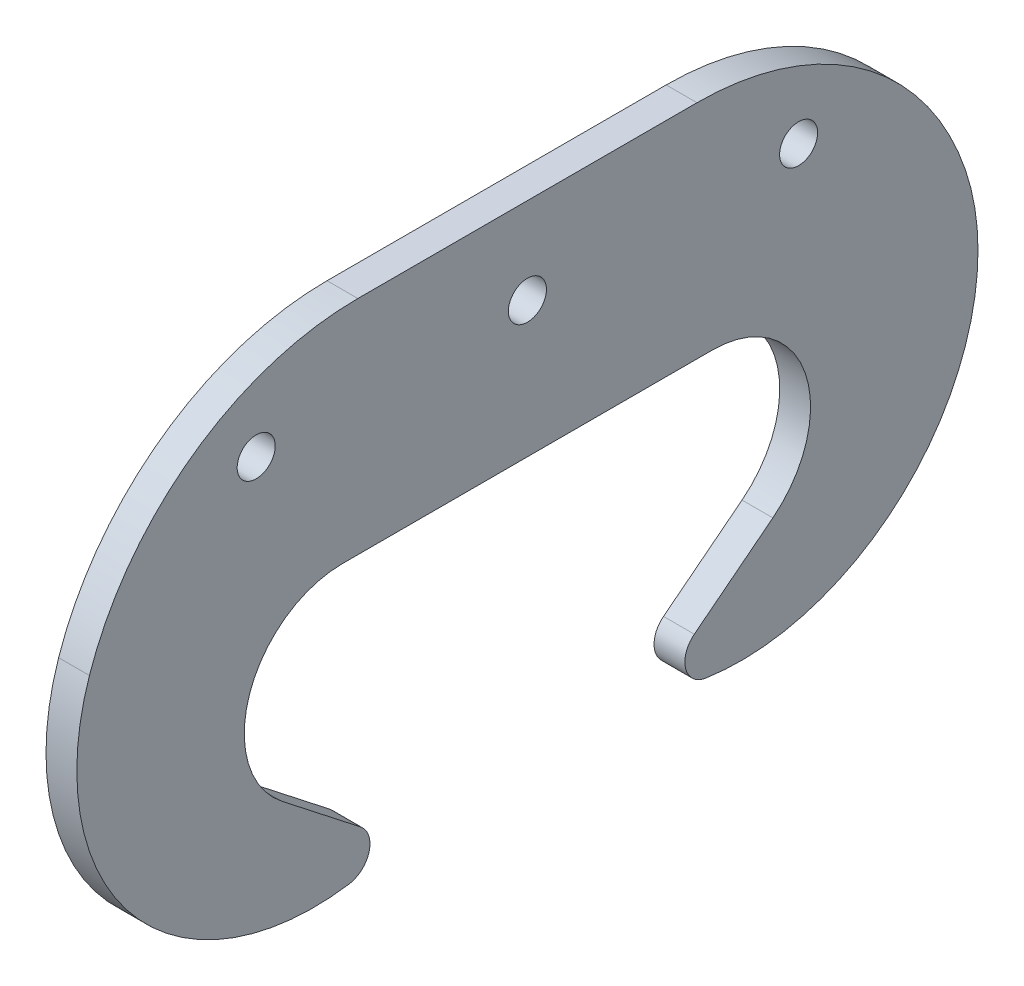
from build123d import *

# Parameters (mm, degrees)
BOSS_EXTRUDE1_DEPTH          = 7.9375
FILLET1_R                    = 25.4
FILLET2_R                    = 16.51
F_3_8_CLEARANCE_HOLE1_D      = 9.8044
EXTRUDE_THIN1_DEPTH          = 7.9375
CUT_EXTRUDE_THIN2_START      = -7.9375
CUT_EXTRUDE_THIN2_DEPTH      = 7.9375
CUT_EXTRUDE_THIN1_DEPTH      = 171.11453265
CUT_EXTRUDE_THIN1_DEPTH_BACK = 152.4
FILLET4_R                    = 6.35


with BuildPart() as part:
    # Sketch1 → Boss-Extrude1 (new body)
    with BuildSketch(Plane(origin=(0, 0, 0), x_dir=(0, 0, -1), z_dir=(1, 0, 0))):
        with BuildLine():
            Line((34.925, -84.1375), (63.5, -84.1375))
            ThreePointArc((63.5, -84.1375), (147.6375, 0), (63.5, 84.1375))
            Line((63.5, 84.1375), (-63.5, 84.1375))
            ThreePointArc((-63.5, 84.1375), (-147.6375, 0), (-63.5, -84.1375))
            Line((-63.5, -84.1375), (-34.925, -84.1375))
            Line((-34.925, -84.1375), (-31.75, -74.6125))
            Line((-31.75, -74.6125), (-68.2625, -46.0375))
            Line((-68.2625, -46.0375), (-68.2625, -4.7625))
            Line((-68.2625, -4.7625), (68.2625, -4.7625))
            Line((68.2625, -4.7625), (68.2625, -46.0375))
            Line((68.2625, -46.0375), (31.75, -74.6125))
            Line((31.75, -74.6125), (34.925, -84.1375))
        make_face()
    extrude(amount=BOSS_EXTRUDE1_DEPTH)

    # Fillet1
    fillet1_edges = [part.edges().sort_by_distance(p)[0] for p in [
        (3.96875, -46.0375, -68.2625),
        (3.96875, -46.0375, 68.2625),
    ]]
    fillet(fillet1_edges, radius=FILLET1_R)

    # Fillet2
    fillet2_edges = [part.edges().sort_by_distance(p)[0] for p in [
        (3.96875, -4.7625, -68.2625),
        (3.96875, -4.7625, 68.2625),
    ]]
    fillet(fillet2_edges, radius=FILLET2_R)

    # 3/8 Clearance Hole1 (through all)
    with Locations(Plane(origin=(7.9375, 30.1625, 69.85), x_dir=(0, 0, 1), z_dir=(1, 0, 0))):
        with Locations((0, 0), (-69.85, 0), (-139.7, 0)):
            Hole(F_3_8_CLEARANCE_HOLE1_D / 2)

    # Sketch9 → Extrude-Thin1 (add)
    with BuildSketch(Plane(origin=(7.9375, 0, 0), x_dir=(0, 0, -1), z_dir=(1, 0, 0))):
        with BuildLine():
            Line((-31.75, -74.6125), (-63.217410815, -49.985830667))
            ThreePointArc((-63.217410815, -49.985830667), (-71.54294782, -21.815600163), (-47.625, -4.7625))
            Line((-47.625, -4.7625), (47.625, -4.7625))
            ThreePointArc((47.625, -4.7625), (71.54294782, -21.815600163), (63.217410815, -49.985830667))
            Line((63.217410815, -49.985830667), (31.75, -74.6125))
            Line((31.75, -74.6125), (34.880845969, -78.613025405))
            Line((34.880845969, -78.613025405), (66.348256784, -53.986356072))
            ThreePointArc((66.348256784, -53.986356072), (76.34550282, -20.159742237), (47.625, 0.3175))
            Line((47.625, 0.3175), (-47.625, 0.3175))
            ThreePointArc((-47.625, 0.3175), (-76.34550282, -20.159742237), (-66.348256784, -53.986356072))
            Line((-66.348256784, -53.986356072), (-34.880845969, -78.613025405))
            Line((-34.880845969, -78.613025405), (-31.75, -74.6125))
        make_face()
    extrude(amount=-EXTRUDE_THIN1_DEPTH)

    # Sketch9<2> → Cut-Extrude-Thin2 (cut)
    with BuildSketch(Plane(origin=(7.9375, 0, 0), x_dir=(0, 0, -1), z_dir=(1, 0, 0)).offset(CUT_EXTRUDE_THIN2_START)):
        with BuildLine():
            Line((-31.75, -74.6125), (-63.217410815, -49.985830667))
            ThreePointArc((-63.217410815, -49.985830667), (-71.54294782, -21.815600163), (-47.625, -4.7625))
            Line((-47.625, -4.7625), (47.625, -4.7625))
            ThreePointArc((47.625, -4.7625), (71.54294782, -21.815600163), (63.217410815, -49.985830667))
            Line((63.217410815, -49.985830667), (31.75, -74.6125))
            Line((31.75, -74.6125), (27.053731046, -68.611711892))
            Line((27.053731046, -68.611711892), (58.521141861, -43.985042559))
            ThreePointArc((58.521141861, -43.985042559), (64.339115319, -24.299387052), (47.625, -12.3825))
            Line((47.625, -12.3825), (-47.625, -12.3825))
            ThreePointArc((-47.625, -12.3825), (-64.339115319, -24.299387052), (-58.521141861, -43.985042559))
            Line((-58.521141861, -43.985042559), (-27.053731046, -68.611711892))
            Line((-27.053731046, -68.611711892), (-31.75, -74.6125))
        make_face()
    extrude(amount=CUT_EXTRUDE_THIN2_DEPTH, mode=Mode.SUBTRACT)

    # Sketch7 → Cut-Extrude-Thin1 (cut, two sides: drawn at the far end of the back side and taken through both)
    with BuildSketch(Plane(origin=(7.9375, 0, 0), x_dir=(0, 0, -1), z_dir=(1, 0, 0)).offset(-CUT_EXTRUDE_THIN1_DEPTH_BACK)):
        with BuildLine():
            Line((31.75, -74.6125), (44.45, -76.851852655))
            ThreePointArc((44.45, -76.851852655), (101.359893984, -56.480810426), (112.805620908, 2.871617747))
            ThreePointArc((112.805620908, 2.871617747), (86.188258708, 38.731700552), (43.668279277, 52.3875))
            Line((43.668279277, 52.3875), (-43.668279277, 52.3875))
            ThreePointArc((-43.668279277, 52.3875), (-86.188258708, 38.731700552), (-112.805620908, 2.871617747))
            ThreePointArc((-112.805620908, 2.871617747), (-101.359893984, -56.480810426), (-44.45, -76.851852655))
            Line((-44.45, -76.851852655), (-31.75, -74.6125))
            Line((-31.75, -74.6125), (-23.810805317, -119.637910468))
            Line((-23.810805317, -119.637910468), (-36.510805317, -121.877263123))
            ThreePointArc((-36.510805317, -121.877263123), (-136.068541071, -86.240316762), (-156.091608712, 17.590369727))
            ThreePointArc((-156.091608712, 17.590369727), (-112.809463221, 75.901982637), (-43.668279277, 98.1075))
            Line((-43.668279277, 98.1075), (43.668279277, 98.1075))
            ThreePointArc((43.668279277, 98.1075), (112.809463221, 75.901982637), (156.091608712, 17.590369727))
            ThreePointArc((156.091608712, 17.590369727), (136.068541071, -86.240316762), (36.510805317, -121.877263123))
            Line((36.510805317, -121.877263123), (23.810805317, -119.637910468))
            Line((23.810805317, -119.637910468), (31.75, -74.6125))
        make_face()
    extrude(amount=CUT_EXTRUDE_THIN1_DEPTH + CUT_EXTRUDE_THIN1_DEPTH_BACK, mode=Mode.SUBTRACT)

    # Fillet4
    fillet4_edges = [part.edges().sort_by_distance(p)[0] for p in [
        (3.96875, -74.6125, 31.75),
        (3.96875, -74.6125, -31.75),
    ]]
    fillet(fillet4_edges, radius=FILLET4_R)


solid = part.part
